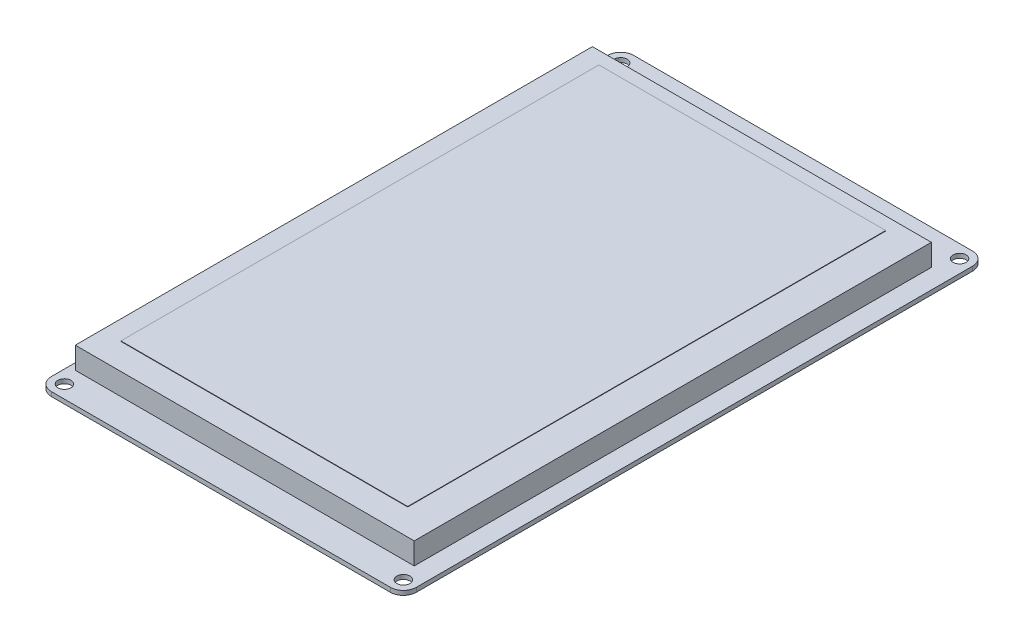
from build123d import *

# Parameters (mm, degrees)
SKETCH1_W           = 78
SKETCH1_H           = 119
BOSS_EXTRUDE1_DEPTH = 6
SKETCH1_3_R         = 1.5
SKETCH1_3_W         = 78
SKETCH1_3_H         = 119
BOSS_EXTRUDE2_DEPTH = 1
SKETCH2_W           = 66
SKETCH2_H           = 110
BOSS_EXTRUDE3_DEPTH = 0.1


with BuildPart() as part:
    # Sketch1 → Boss-Extrude1 (new body)
    with BuildSketch(Plane(origin=(0, 0, 0), x_dir=(1, 0, 0), z_dir=(0, 1, 0))):
        with Locations((-1.5, -10.636986301)):
            Rectangle(SKETCH1_W, SKETCH1_H)
    extrude(amount=BOSS_EXTRUDE1_DEPTH)

    # Sketch1<3> → Boss-Extrude2 (add)
    with BuildSketch(Plane(origin=(0, 0, 0), x_dir=(1, 0, 0), z_dir=(0, 1, 0))):
        with BuildLine():
            Line((-39, 56.863013699), (39, 56.863013699))
            ThreePointArc((39, 56.863013699), (41.121320344, 55.984334042), (42, 53.863013699))
            Line((42, 53.863013699), (42, -74.136986301))
            ThreePointArc((42, -74.136986301), (41.121320344, -76.258306645), (39, -77.136986301))
            Line((39, -77.136986301), (-39, -77.136986301))
            ThreePointArc((-39, -77.136986301), (-41.121320344, -76.258306645), (-42, -74.136986301))
            Line((-42, -74.136986301), (-42, 53.863013699))
            ThreePointArc((-42, 53.863013699), (-41.121320344, 55.984334042), (-39, 56.863013699))
        make_face()
        with Locations((-39, 53.863013699)):
            Circle(SKETCH1_3_R, mode=Mode.SUBTRACT)
        with Locations((39, 53.863013699)):
            Circle(SKETCH1_3_R, mode=Mode.SUBTRACT)
        with Locations((-39, -74.136986301)):
            Circle(SKETCH1_3_R, mode=Mode.SUBTRACT)
        with Locations((39, -74.136986301)):
            Circle(SKETCH1_3_R, mode=Mode.SUBTRACT)
        with Locations((-1.5, -10.636986301)):
            Rectangle(SKETCH1_3_W, SKETCH1_3_H, mode=Mode.SUBTRACT)
    extrude(amount=BOSS_EXTRUDE2_DEPTH)

    # Sketch2 → Boss-Extrude3 (add)
    with BuildSketch(Plane(origin=(0, 6, 0), x_dir=(1, 0, 0), z_dir=(0, 1, 0))):
        with Locations((-3, -9.136986301)):
            Rectangle(SKETCH2_W, SKETCH2_H)
    extrude(amount=BOSS_EXTRUDE3_DEPTH)


solid = part.part
